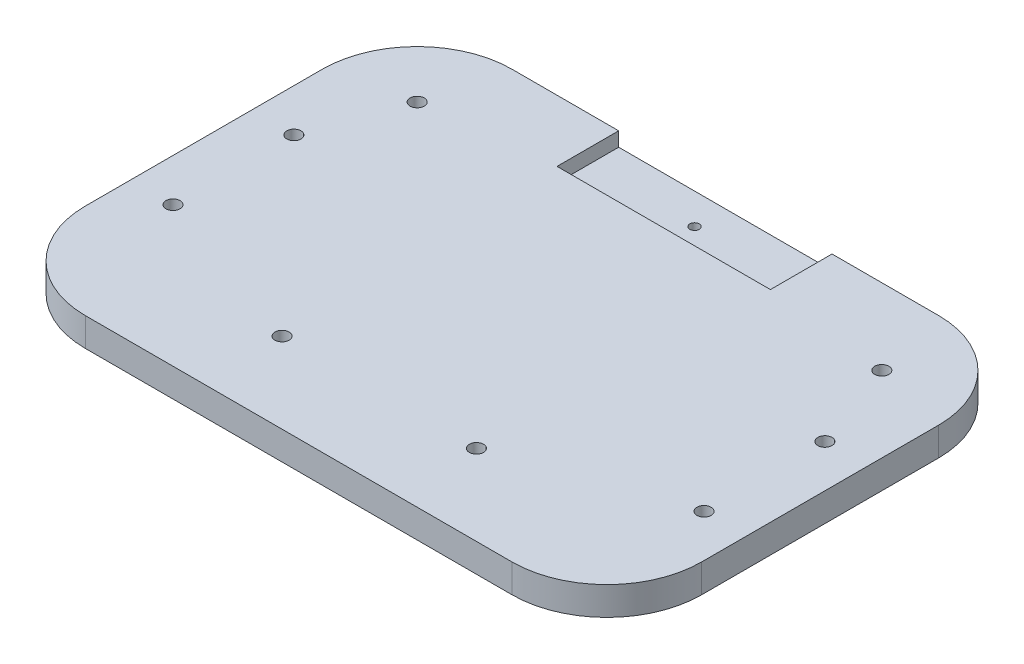
from build123d import *

# Parameters (mm, degrees)
BOSS_EXTRUDE1_DEPTH       = 6
SKETCH3_W                 = 45
SKETCH3_H                 = 13
CUT_EXTRUDE1_DEPTH        = 3
F_2_0MM_DOWEL_HOLE1_D     = 2
F_2_0MM_DOWEL_HOLE1_DEPTH = 12
F_2_0MM_DOWEL_HOLE1_TIP   = 0.600860619
F_3_0MM_DOWEL_HOLE1_D     = 3
F_3_0MM_DOWEL_HOLE1_DEPTH = 12
F_3_0MM_DOWEL_HOLE1_TIP   = 0.901290929


with BuildPart() as part:
    # Sketch2 → Boss-Extrude1 (new body)
    with BuildSketch(Plane(origin=(0, 0, 0), x_dir=(1, 0, 0), z_dir=(0, 1, 0))):
        with BuildLine():
            Line((-20, 0), (-110, 0))
            ThreePointArc((-110, 0), (-124.142135624, 5.857864376), (-130, 20))
            Line((-130, 20), (-130, 70))
            ThreePointArc((-130, 70), (-124.142135624, 84.142135624), (-110, 90))
            Line((-110, 90), (-20, 90))
            ThreePointArc((-20, 90), (-5.857864376, 84.142135624), (0, 70))
            Line((0, 70), (0, 20))
            ThreePointArc((0, 20), (-5.857864376, 5.857864376), (-20, 0))
        make_face()
    extrude(amount=BOSS_EXTRUDE1_DEPTH)

    # Sketch3 → Cut-Extrude1 (cut)
    with BuildSketch(Plane(origin=(0, 6, 0), x_dir=(1, 0, 0), z_dir=(0, 1, 0))):
        with Locations((-65, 83.5)):
            Rectangle(SKETCH3_W, SKETCH3_H)
    extrude(amount=-CUT_EXTRUDE1_DEPTH, mode=Mode.SUBTRACT)

    # Ø2.0mm Dowel Hole1
    with Locations(Plane(origin=(0, 3, 0), x_dir=(1, 0, 0), z_dir=(0, 1, 0))):
        with Locations((-65, 83.5)):
            Hole(F_2_0MM_DOWEL_HOLE1_D / 2, depth=F_2_0MM_DOWEL_HOLE1_DEPTH)
            with Locations((0, 0, -(F_2_0MM_DOWEL_HOLE1_DEPTH + F_2_0MM_DOWEL_HOLE1_TIP / 2))):  # 118° drill point
                Cone(0, F_2_0MM_DOWEL_HOLE1_D / 2, F_2_0MM_DOWEL_HOLE1_TIP, mode=Mode.SUBTRACT)

    # Ø3.0mm Dowel Hole1
    with Locations(Plane(origin=(0, 6, 0), x_dir=(1, 0, 0), z_dir=(0, 1, 0))):
        with Locations((-114, 74), (-16, 74), (-121, 55), (-9, 55), (-121, 29.5), (-9, 29.5), (-85.5, 17), (-44.5, 17)):
            Hole(F_3_0MM_DOWEL_HOLE1_D / 2, depth=F_3_0MM_DOWEL_HOLE1_DEPTH)
            with Locations((0, 0, -(F_3_0MM_DOWEL_HOLE1_DEPTH + F_3_0MM_DOWEL_HOLE1_TIP / 2))):  # 118° drill point
                Cone(0, F_3_0MM_DOWEL_HOLE1_D / 2, F_3_0MM_DOWEL_HOLE1_TIP, mode=Mode.SUBTRACT)


solid = part.part
